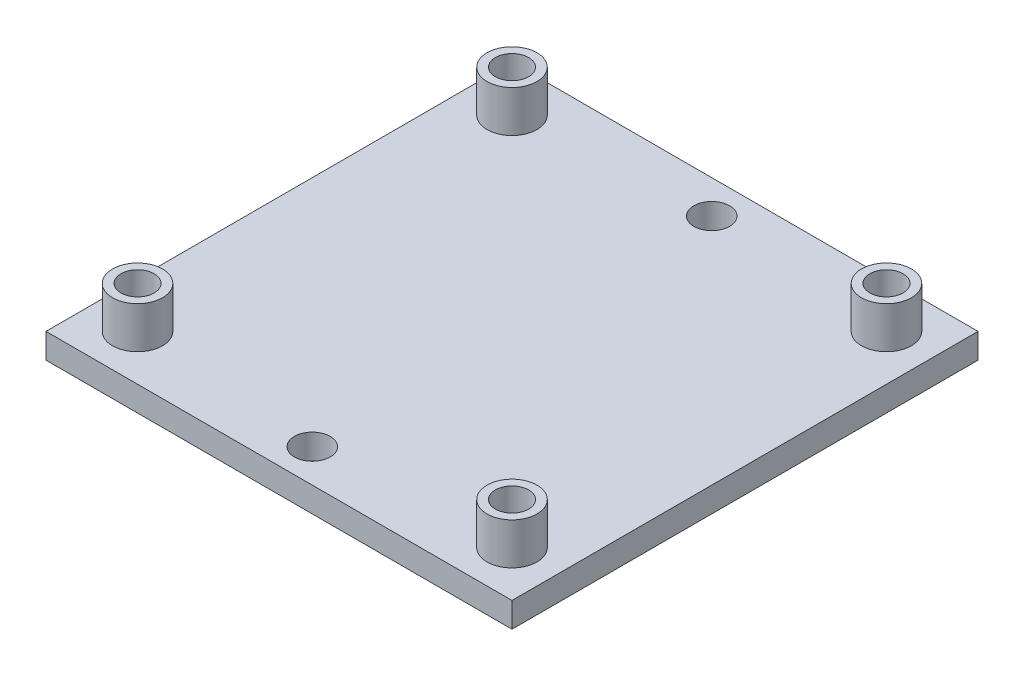
from build123d import *

# Parameters (mm, degrees)
SK_PLATE_W           = 56
SK_PLATE_H           = 56
EX_PLATE_DEPTH       = 3
SK_STANDOFFS_R       = 3
EX_STANDOFFS_DEPTH   = 5
SK_INSERTS_M3_R      = 2
CUT_INSERTS_M3_DEPTH = 5.7
SK_PANHOLES_R        = 2.15
CUT_PANHOLES_DEPTH   = 3


with BuildPart() as part:
    # SK_Plate → EX_Plate (new body)
    with BuildSketch(Plane(origin=(0, 0, 0), x_dir=(1, 0, 0), z_dir=(0, 1, 0))):
        Rectangle(SK_PLATE_W, SK_PLATE_H)
    extrude(amount=EX_PLATE_DEPTH)

    # SK_Standoffs → EX_Standoffs (add)
    with BuildSketch(Plane(origin=(0, 3, 0), x_dir=(1, 0, 0), z_dir=(0, 1, 0))):
        with Locations((22.5, -22.5)):
            Circle(SK_STANDOFFS_R)
        with Locations((-22.5, -22.5)):
            Circle(SK_STANDOFFS_R)
        with Locations((22.5, 22.5)):
            Circle(SK_STANDOFFS_R)
        with Locations((-22.5, 22.5)):
            Circle(SK_STANDOFFS_R)
    extrude(amount=EX_STANDOFFS_DEPTH)

    # SK_Inserts_M3 → CUT_Inserts_M3 (cut)
    with BuildSketch(Plane(origin=(0, 8, 0), x_dir=(1, 0, 0), z_dir=(0, 1, 0))):
        with Locations((22.5, -22.5)):
            Circle(SK_INSERTS_M3_R)
        with Locations((-22.5, -22.5)):
            Circle(SK_INSERTS_M3_R)
        with Locations((22.5, 22.5)):
            Circle(SK_INSERTS_M3_R)
        with Locations((-22.5, 22.5)):
            Circle(SK_INSERTS_M3_R)
    extrude(amount=-CUT_INSERTS_M3_DEPTH, mode=Mode.SUBTRACT)

    # SK_PanHoles → CUT_PanHoles (cut)
    with BuildSketch(Plane(origin=(0, 0, 0), x_dir=(1, 0, 0), z_dir=(0, 1, 0))):
        with Locations((0, -24)):
            Circle(SK_PANHOLES_R)
        with Locations((0, 24)):
            Circle(SK_PANHOLES_R)
    extrude(amount=CUT_PANHOLES_DEPTH, mode=Mode.SUBTRACT)


solid = part.part
